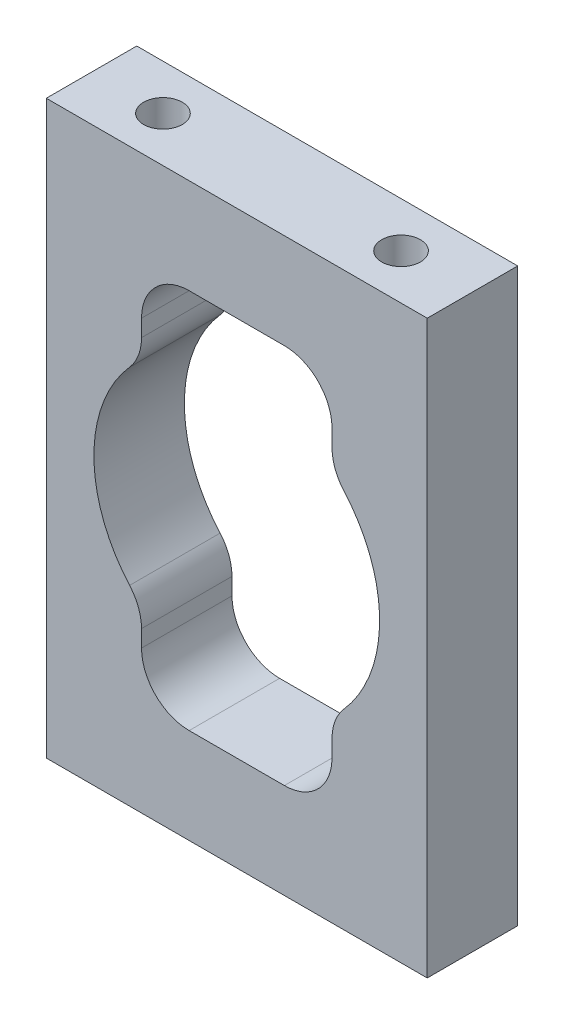
from build123d import *

# Parameters (mm, degrees)
SKETCH1_W                                 = 50.8
SKETCH1_H                                 = 63.5
BOSS_EXTRUDE1_DEPTH                       = 12.065
SKETCH6_W                                 = 50.8
SKETCH6_H                                 = 12.065
BOSS_EXTRUDE2_DEPTH                       = 6.35
F_13_64_0_20313_DIAMETER_HOLE1_AT_2_COUNT = 2
F_13_64_0_20313_DIAMETER_HOLE1_AT_2_PITCH = 31.75
SKETCH12_W                                = 25.4
SKETCH12_H                                = 50.8
CUT_EXTRUDE7_DEPTH                        = 48.353291596
FILLET1_R                                 = 6.35
SKETCH13_R                                = 19.05
CUT_EXTRUDE8_DEPTH                        = 48.353291596
FILLET2_R                                 = 6.35


with BuildPart() as part:
    # Sketch1 → Boss-Extrude1 (new body)
    with BuildSketch(Plane.XY):
        Rectangle(SKETCH1_W, SKETCH1_H)
    extrude(amount=BOSS_EXTRUDE1_DEPTH)

    # Sketch6 → Boss-Extrude2 (add)
    with BuildSketch(Plane.XZ.offset(31.75)):
        with Locations((0, 6.0325)):
            Rectangle(SKETCH6_W, SKETCH6_H)
    boss_extrude2 = extrude(amount=BOSS_EXTRUDE2_DEPTH)

    # Sketch8 → 13/64 (0.20313) Diameter Hole1 (revolve, cut)
    with BuildSketch(Plane(origin=(-15.875, -38.1, 6.0325), x_dir=(0, 0, -1), z_dir=(1, 0, 0))):
        Polygon((0, 0), (0, 16.790070783), (2.579751, 15.24), (2.579751, 0), align=None)
    f_13_64_0_20313_diameter_hole1 = revolve(axis=Axis((-15.875, -44.45, 6.0325), (0, 1, 0)), mode=Mode.SUBTRACT)

    # 13/64 (0.20313) Diameter Hole1 at 2: 13/64 (0.20313) Diameter Hole1 ×2
    with Locations(*[(i * F_13_64_0_20313_DIAMETER_HOLE1_AT_2_PITCH, 0, 0) for i in range(1, F_13_64_0_20313_DIAMETER_HOLE1_AT_2_COUNT)]):
        add(f_13_64_0_20313_diameter_hole1, mode=Mode.SUBTRACT)

    # Mirror2: Boss-Extrude2, 13/64 (0.20313) Diameter Hole1 across plane
    add(boss_extrude2.mirror(Plane.ZX))
    add(f_13_64_0_20313_diameter_hole1.mirror(Plane.ZX), mode=Mode.SUBTRACT)

    # Mirror2 copy 1 sketch → Mirror2 copy 1 (revolve, cut)
    with BuildSketch(Plane(origin=(15.875, 38.1, 6.0325), x_dir=(0, 0, -1), z_dir=(1, 0, 0))):
        Polygon((0, 0), (0, -16.790070783), (2.579751, -15.24), (2.579751, 0), align=None)
    revolve(axis=Axis((15.875, 44.45, 6.0325), (0, 1, 0)), mode=Mode.SUBTRACT)

    # Sketch12 → Cut-Extrude7 (cut, through all)
    with BuildSketch(Plane.XY.offset(12.065)):
        Rectangle(SKETCH12_W, SKETCH12_H)
    extrude(amount=-CUT_EXTRUDE7_DEPTH, mode=Mode.SUBTRACT)

    # Fillet1
    fillet1_edges = [part.edges().sort_by_distance(p)[0] for p in [
        (-12.7, -25.4, 6.0325),
        (12.7, -25.4, 6.0325),
        (12.7, 25.4, 6.0325),
        (-12.7, 25.4, 6.0325),
    ]]
    fillet(fillet1_edges, radius=FILLET1_R)

    # Sketch13 → Cut-Extrude8 (cut, through all)
    with BuildSketch(Plane(origin=(0, 0, 0), x_dir=(-1, 0, 0), z_dir=(0, 0, -1))):
        Circle(SKETCH13_R)
    extrude(amount=-CUT_EXTRUDE8_DEPTH, mode=Mode.SUBTRACT)

    # Fillet2
    fillet2_edges = [part.edges().sort_by_distance(p)[0] for p in [
        (-12.7, 14.199031657, 6.0325),
        (-12.7, -14.199031657, 6.0325),
        (12.7, -14.199031657, 6.0325),
        (12.7, 14.199031657, 6.0325),
    ]]
    fillet(fillet2_edges, radius=FILLET2_R)


solid = part.part
